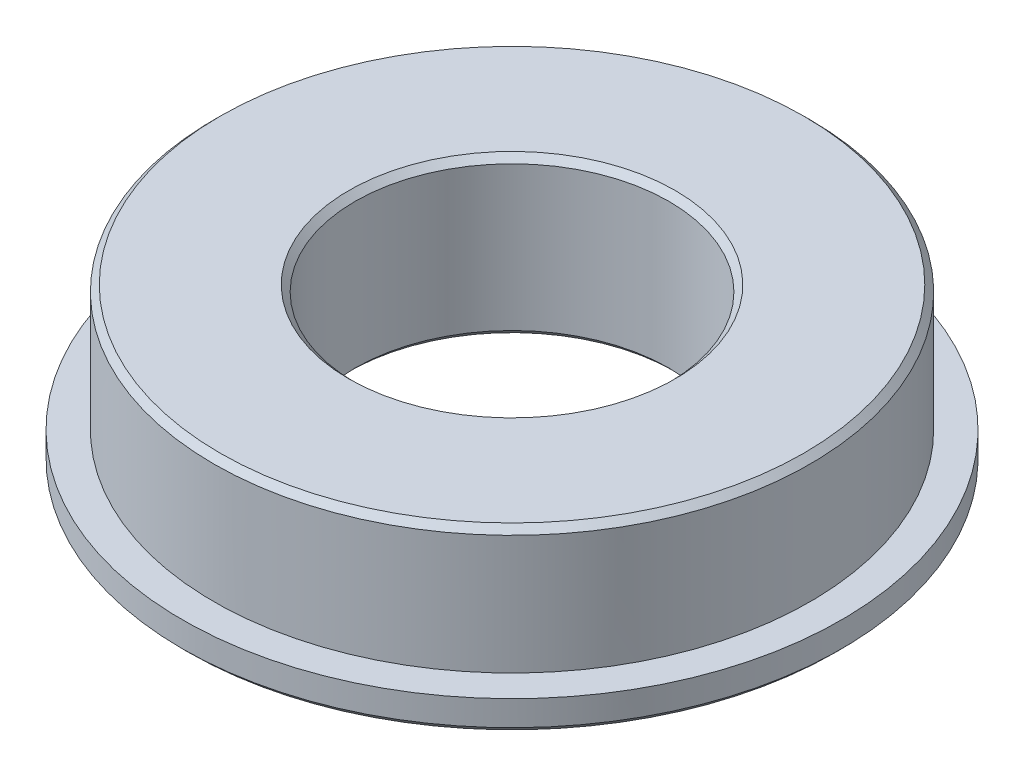
from build123d import *

# Parameters (mm, degrees)
SKETCH_1_R      = 9.5
SKETCH_1_R_2    = 5
EXTRUDE_1_DEPTH = 5
SKETCH_2_R      = 10.5
SKETCH_2_R_2    = 9.5
EXTRUDE_2_DEPTH = 1
CHAMFER_1_SIZE  = 0.2


with BuildPart() as part:
    # 草图1 → 凸台-拉伸1 (new body)
    with BuildSketch(Plane(origin=(0, 0, 0), x_dir=(1, 0, 0), z_dir=(0, 1, 0))):
        with Locations(Location((0, 0, 0), (0, 0, 270))):
            Circle(SKETCH_1_R)
        with Locations(Location((0, 0, 0), (0, 0, 270))):
            Circle(SKETCH_1_R_2, mode=Mode.SUBTRACT)
    extrude(amount=EXTRUDE_1_DEPTH)

    # 草图2 → 凸台-拉伸2 (add)
    with BuildSketch(Plane.XZ):
        with Locations(Location((0, 0, 0), (0, 0, 270))):
            Circle(SKETCH_2_R)
        with Locations(Location((0, 0, 0), (0, 0, 270))):
            Circle(SKETCH_2_R_2, mode=Mode.SUBTRACT)
    extrude(amount=-EXTRUDE_2_DEPTH)

    # 倒角1
    chamfer_1_edges = [part.edges().sort_by_distance(p)[0] for p in [
        (0, 0, 10.5),
        (0, 5, -9.5),
        (0, 0, -5),
        (0, 5, -5),
    ]]
    chamfer(chamfer_1_edges, length=CHAMFER_1_SIZE)


solid = part.part
